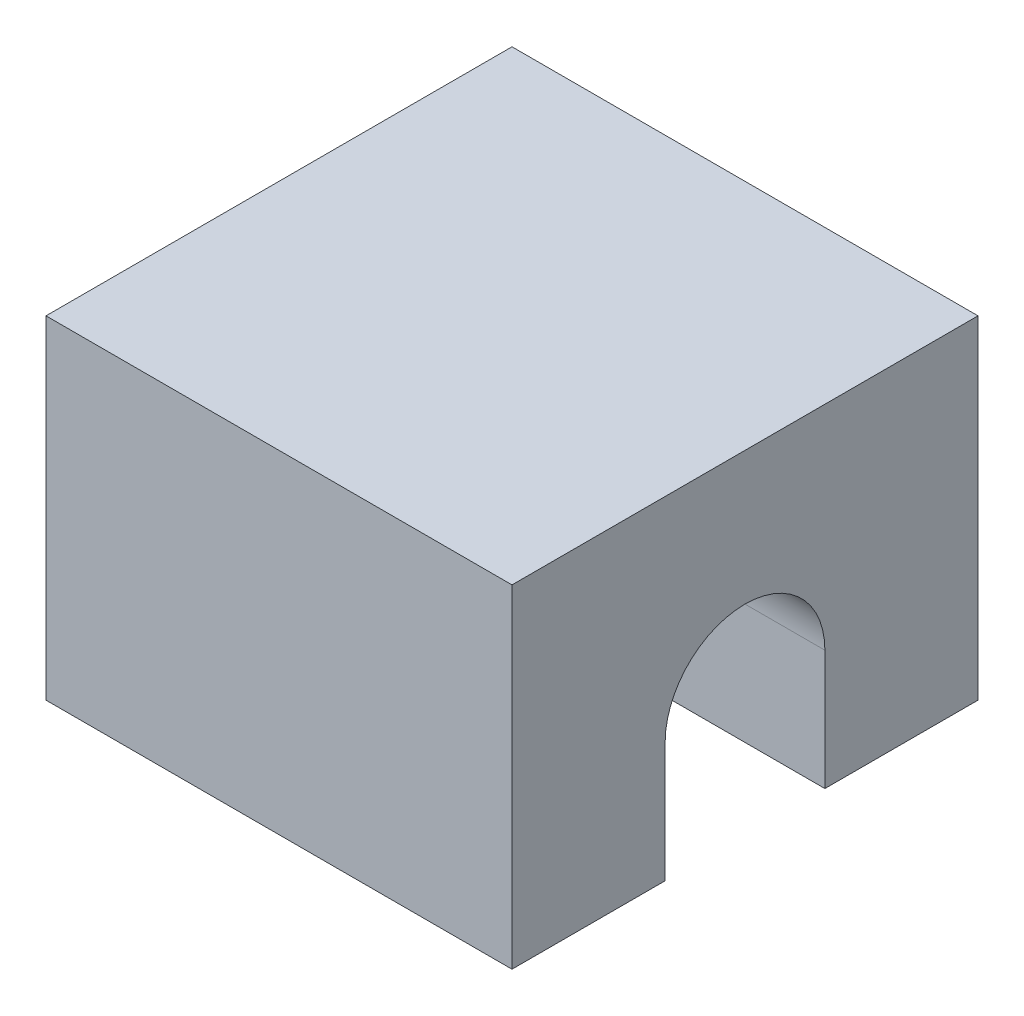
from build123d import *

# Parameters (mm, degrees)
BOSS_EXTRUDE1_DEPTH = 35


with BuildPart() as part:
    # Sketch1 → Boss-Extrude1 (new body)
    with BuildSketch(Plane(origin=(0, 0, 0), x_dir=(0, 0, -1), z_dir=(1, 0, 0))):
        with BuildLine():
            Line((-8.82183908, 6.781609195), (-8.82183908, 16.781609195))
            Line((-8.82183908, 16.781609195), (-26.32183908, 16.781609195))
            Line((-26.32183908, 16.781609195), (-26.32183908, -8.218390805))
            Line((-26.32183908, -8.218390805), (-14.82183908, -8.218390805))
            Line((-14.82183908, -8.218390805), (-14.82183908, 0.781609195))
            ThreePointArc((-14.82183908, 0.781609195), (-13.064479768, 5.024249883), (-8.82183908, 6.781609195))
        make_face()
        with BuildLine():
            Line((8.67816092, 16.781609195), (-8.82183908, 16.781609195))
            Line((-8.82183908, 16.781609195), (-8.82183908, 6.781609195))
            ThreePointArc((-8.82183908, 6.781609195), (-4.579198393, 5.024249883), (-2.82183908, 0.781609195))
            Line((-2.82183908, 0.781609195), (-2.82183908, -8.218390805))
            Line((-2.82183908, -8.218390805), (8.67816092, -8.218390805))
            Line((8.67816092, -8.218390805), (8.67816092, 16.781609195))
        make_face()
    extrude(amount=BOSS_EXTRUDE1_DEPTH)


solid = part.part
